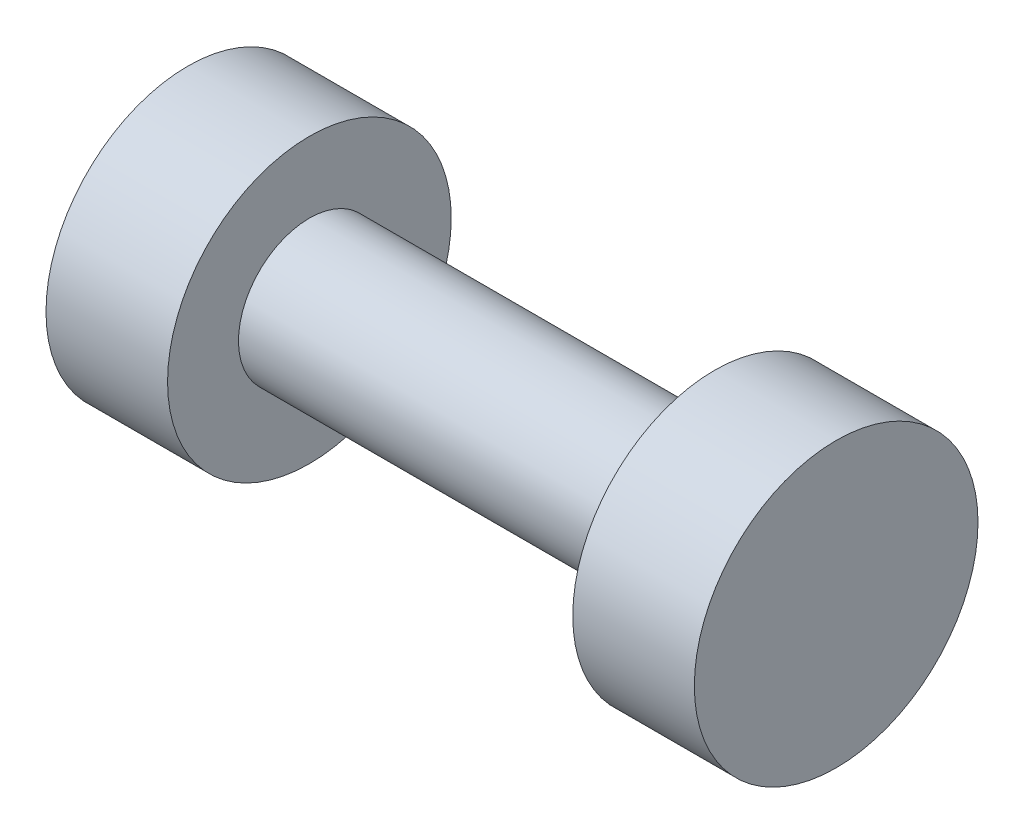
from build123d import *


with BuildPart() as part:
    # Sketch1 → Revolve1 (revolve)
    with BuildSketch(Plane.XY):
        Polygon((-80, 0), (-80, 35), (-50, 35), (-50, 17.5), (50, 17.5), (50, 35), (80, 35), (80, 0), align=None)
    revolve(axis=Axis((80, 0, 0), (-1, 0, 0)))


solid = part.part
